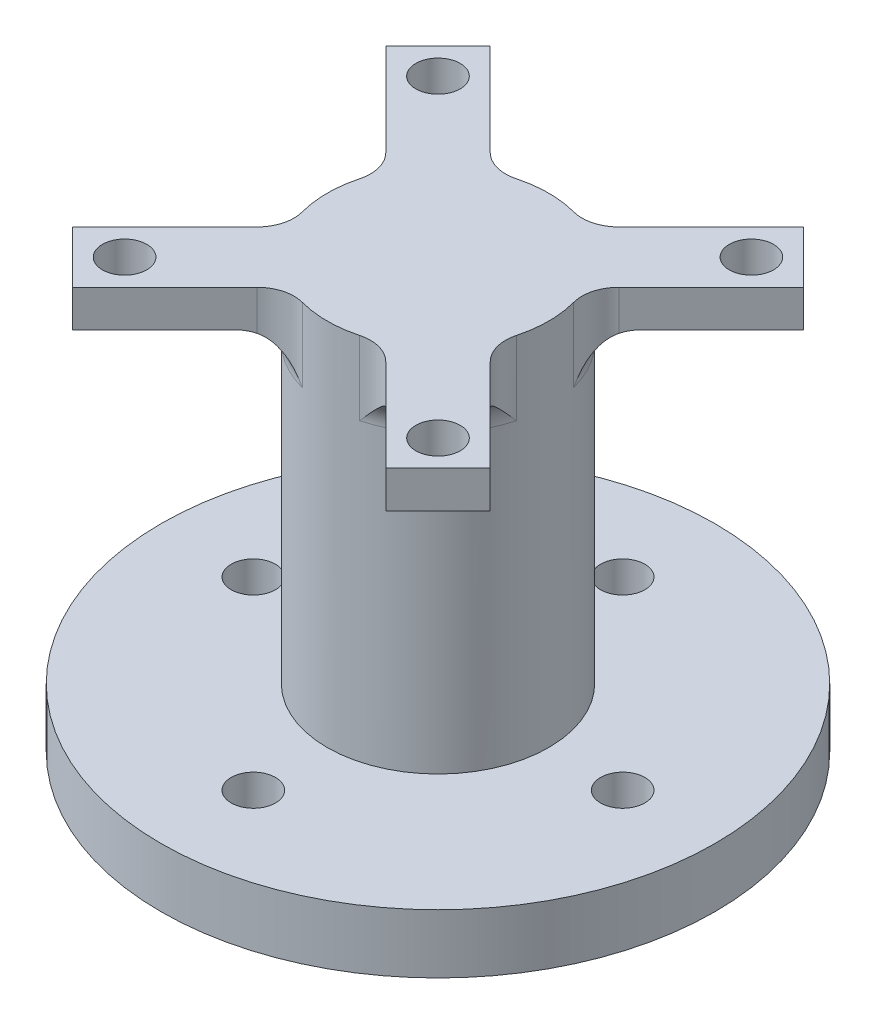
from build123d import *

# Parameters (mm, degrees)
SKETCH1_R           = 37.5
BOSS_EXTRUDE1_DEPTH = 8
SKETCH2_R           = 3
CUT_EXTRUDE1_DEPTH  = 54.633012222
SKETCH3_R           = 15
BOSS_EXTRUDE2_DEPTH = 50
BOSS_EXTRUDE4_START = -5
BOSS_EXTRUDE4_DEPTH = 5
CUT_EXTRUDE2_REACH  = 80.591
SKETCH5_R           = 3
FILLET1_R           = 5


with BuildPart() as part:
    # Sketch1 → Boss-Extrude1 (new body)
    with BuildSketch(Plane(origin=(0, 0, 0), x_dir=(1, 0, 0), z_dir=(0, 1, 0))):
        with Locations(Location((0, 0, 0), (0, 0, 270))):
            Circle(SKETCH1_R)
    extrude(amount=BOSS_EXTRUDE1_DEPTH)

    # Sketch2 → Cut-Extrude1 (cut, through all)
    with BuildSketch(Plane(origin=(0, 8, 0), x_dir=(1, 0, 0), z_dir=(0, 1, 0))):
        with Locations(Location((25, 0, 0), (0, 0, 270))):
            Circle(SKETCH2_R)
        with Locations(Location((0, 25, 0), (0, 0, 270))):
            Circle(SKETCH2_R)
        with Locations(Location((-25, 0, 0), (0, 0, 270))):
            Circle(SKETCH2_R)
        with Locations(Location((0, -25, 0), (0, 0, 270))):
            Circle(SKETCH2_R)
    extrude(amount=-CUT_EXTRUDE1_DEPTH, mode=Mode.SUBTRACT)

    # Sketch3 → Boss-Extrude2 (add)
    with BuildSketch(Plane(origin=(0, 8, 0), x_dir=(1, 0, 0), z_dir=(0, 1, 0))):
        with Locations(Location((0, 0, 0), (0, 0, 270))):
            Circle(SKETCH3_R)
    extrude(amount=BOSS_EXTRUDE2_DEPTH)

    # Sketch7 → Boss-Extrude4 (add)
    with BuildSketch(Plane(origin=(0, 58, 0), x_dir=(1, 0, 0), z_dir=(0, 1, 0)).offset(BOSS_EXTRUDE4_START)):
        with BuildLine():
            ThreePointArc((-6.464466094, -13.535533906), (-10.606601718, -10.606601718), (-13.535533906, -6.464466094))
            Line((-13.535533906, -6.464466094), (-28.284271247, -21.213203436))
            Line((-28.284271247, -21.213203436), (-21.213203436, -28.284271247))
            Line((-21.213203436, -28.284271247), (-6.464466094, -13.535533906))
        make_face()
        with BuildLine():
            Line((0, -7.071067812), (-7.071067812, 0))
            Line((-7.071067812, 0), (-13.535533906, -6.464466094))
            ThreePointArc((-13.535533906, -6.464466094), (-10.606601718, -10.606601718), (-6.464466094, -13.535533906))
            Line((-6.464466094, -13.535533906), (0, -7.071067812))
        make_face()
        with BuildLine():
            ThreePointArc((13.535533906, -6.464466094), (10.606601718, -10.606601718), (6.464466094, -13.535533906))
            Line((6.464466094, -13.535533906), (21.213203436, -28.284271247))
            Line((21.213203436, -28.284271247), (28.284271247, -21.213203436))
            Line((28.284271247, -21.213203436), (13.535533906, -6.464466094))
        make_face()
        Polygon((0, 7.071067812), (-7.071067812, 0), (0, -7.071067812), (7.071067812, 0), align=None)
        with BuildLine():
            Line((7.071067812, 0), (0, -7.071067812))
            Line((0, -7.071067812), (6.464466094, -13.535533906))
            ThreePointArc((6.464466094, -13.535533906), (10.606601718, -10.606601718), (13.535533906, -6.464466094))
            Line((13.535533906, -6.464466094), (7.071067812, 0))
        make_face()
        with BuildLine():
            Line((21.213203436, 28.284271247), (6.464466094, 13.535533906))
            ThreePointArc((6.464466094, 13.535533906), (10.606601718, 10.606601718), (13.535533906, 6.464466094))
            Line((13.535533906, 6.464466094), (28.284271247, 21.213203436))
            Line((28.284271247, 21.213203436), (21.213203436, 28.284271247))
        make_face()
        with BuildLine():
            Line((6.464466094, 13.535533906), (0, 7.071067812))
            Line((0, 7.071067812), (7.071067812, 0))
            Line((7.071067812, 0), (13.535533906, 6.464466094))
            ThreePointArc((13.535533906, 6.464466094), (10.606601718, 10.606601718), (6.464466094, 13.535533906))
        make_face()
        with BuildLine():
            Line((-21.213203436, 28.284271247), (-28.284271247, 21.213203436))
            Line((-28.284271247, 21.213203436), (-13.535533906, 6.464466094))
            ThreePointArc((-13.535533906, 6.464466094), (-10.606601718, 10.606601718), (-6.464466094, 13.535533906))
            Line((-6.464466094, 13.535533906), (-21.213203436, 28.284271247))
        make_face()
        with BuildLine():
            ThreePointArc((-6.464466094, 13.535533906), (-10.606601718, 10.606601718), (-13.535533906, 6.464466094))
            Line((-13.535533906, 6.464466094), (-7.071067812, 0))
            Line((-7.071067812, 0), (0, 7.071067812))
            Line((0, 7.071067812), (-6.464466094, 13.535533906))
        make_face()
    extrude(amount=BOSS_EXTRUDE4_DEPTH)

    # Sketch5 → Cut-Extrude2 (cut, up to next)
    with BuildSketch(Plane(origin=(0, 58, 0), x_dir=(1, 0, 0), z_dir=(0, 1, 0)), mode=Mode.PRIVATE) as cut_extrude2_sk1:
        with Locations(Location((21.213203436, -21.213203436, 0), (0, 0, 270))):
            Circle(SKETCH5_R)
    cut_extrude2_tool1 = extrude(cut_extrude2_sk1.sketch, amount=-CUT_EXTRUDE2_REACH, mode=Mode.PRIVATE) & part.part
    # Sketch5 → Cut-Extrude2 (cut, up to next)
    with BuildSketch(Plane(origin=(0, 58, 0), x_dir=(1, 0, 0), z_dir=(0, 1, 0)), mode=Mode.PRIVATE) as cut_extrude2_sk2:
        with Locations(Location((-21.213203436, 21.213203436, 0), (0, 0, 270))):
            Circle(SKETCH5_R)
    cut_extrude2_tool2 = extrude(cut_extrude2_sk2.sketch, amount=-CUT_EXTRUDE2_REACH, mode=Mode.PRIVATE) & part.part
    # Sketch5 → Cut-Extrude2 (cut, up to next)
    with BuildSketch(Plane(origin=(0, 58, 0), x_dir=(1, 0, 0), z_dir=(0, 1, 0)), mode=Mode.PRIVATE) as cut_extrude2_sk3:
        with Locations(Location((-21.213203436, -21.213203436, 0), (0, 0, 270))):
            Circle(SKETCH5_R)
    cut_extrude2_tool3 = extrude(cut_extrude2_sk3.sketch, amount=-CUT_EXTRUDE2_REACH, mode=Mode.PRIVATE) & part.part
    # Sketch5 → Cut-Extrude2 (cut, up to next)
    with BuildSketch(Plane(origin=(0, 58, 0), x_dir=(1, 0, 0), z_dir=(0, 1, 0)), mode=Mode.PRIVATE) as cut_extrude2_sk4:
        with Locations(Location((21.213203436, 21.213203436, 0), (0, 0, 270))):
            Circle(SKETCH5_R)
    cut_extrude2_tool4 = extrude(cut_extrude2_sk4.sketch, amount=-CUT_EXTRUDE2_REACH, mode=Mode.PRIVATE) & part.part
    add(cut_extrude2_tool1.solids().sort_by_distance((21.213203, 58, 21.213203))[0], mode=Mode.SUBTRACT)
    add(cut_extrude2_tool2.solids().sort_by_distance((-21.213203, 58, -21.213203))[0], mode=Mode.SUBTRACT)
    add(cut_extrude2_tool3.solids().sort_by_distance((-21.213203, 58, 21.213203))[0], mode=Mode.SUBTRACT)
    add(cut_extrude2_tool4.solids().sort_by_distance((21.213203, 58, -21.213203))[0], mode=Mode.SUBTRACT)

    # Fillet1
    fillet1_edges = [part.edges().sort_by_distance(p)[0] for p in [
        (-10.606601718, 53, 10.606601718),
        (-10.606601718, 53, -10.606601718),
        (10.606601718, 53, -10.606601718),
        (10.606601718, 53, 10.606601718),
        (13.535533906, 55.5, 6.464466094),
        (-13.535533906, 55.5, 6.464466094),
        (-6.464466094, 55.5, -13.535533906),
        (6.464466094, 55.5, -13.535533906),
        (6.464466094, 55.5, 13.535533906),
        (-6.464466094, 55.5, 13.535533906),
        (-13.535533906, 55.5, -6.464466094),
        (13.535533906, 55.5, -6.464466094),
    ]]
    fillet(fillet1_edges, radius=FILLET1_R)


solid = part.part
